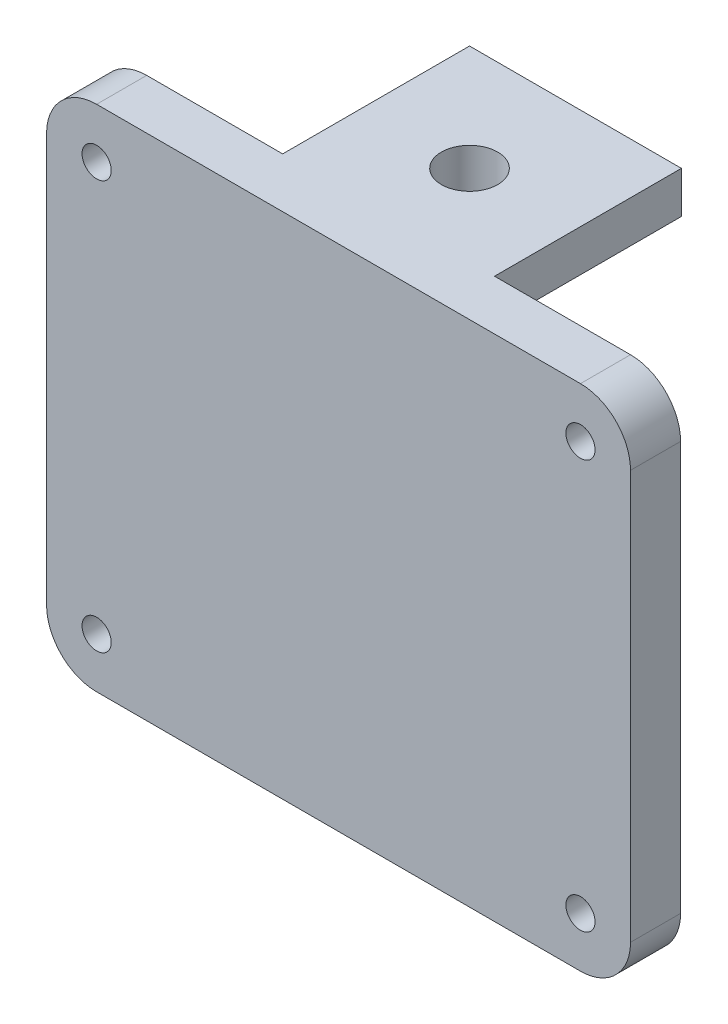
from build123d import *

# Parameters (mm, degrees)
SKETCH1_W               = 25.4
SKETCH1_H               = 25.4
BOSS_EXTRUDE1_DEPTH     = 5
F_1_4_CLEARANCE_HOLE1_D = 6.7564
SKETCH4_R               = 1.75
SKETCH4_W               = 25.4
SKETCH4_H               = 5
BOSS_EXTRUDE2_DEPTH     = 3
FILLET1_R               = 6


with BuildPart() as part:
    # Sketch1 → Boss-Extrude1 (new body)
    with BuildSketch(Plane(origin=(0, 0, 0), x_dir=(1, 0, 0), z_dir=(0, 1, 0))):
        Rectangle(SKETCH1_W, SKETCH1_H)
    extrude(amount=BOSS_EXTRUDE1_DEPTH)

    # 1/4 Clearance Hole1 (through all)
    with Locations(Plane(origin=(0, 5, 0), x_dir=(1, 0, 0), z_dir=(0, 1, 0))):
        with Locations((0, 0)):
            Hole(F_1_4_CLEARANCE_HOLE1_D / 2)

    # Sketch4 → Boss-Extrude2 (add, symmetric)
    # profile 1 of 2: a face of its own
    with BuildSketch(Plane.XY.offset(12.7)):
        Polygon((-35, 5), (-35, -56), (35, -56), (35, 5), (12.7, 5), (12.7, 0), (-12.7, 0), (-12.7, 5), align=None)
        with Locations((-29, -50)):
            Circle(SKETCH4_R, mode=Mode.SUBTRACT)
        with Locations((29, -50)):
            Circle(SKETCH4_R, mode=Mode.SUBTRACT)
        with Locations((-29, -1)):
            Circle(SKETCH4_R, mode=Mode.SUBTRACT)
        with Locations((29, -1)):
            Circle(SKETCH4_R, mode=Mode.SUBTRACT)
    # profile 2 of 2: a face of its own
    with BuildSketch(Plane.XY.offset(12.7)):
        with Locations((0, 2.5)):
            Rectangle(SKETCH4_W, SKETCH4_H)
    extrude(amount=BOSS_EXTRUDE2_DEPTH, both=True)

    # Fillet1
    fillet1_edges = [part.edges().sort_by_distance(p)[0] for p in [
        (-35, 5, 12.7),
        (35, 5, 12.7),
        (35, -56, 12.7),
        (-35, -56, 12.7),
    ]]
    fillet(fillet1_edges, radius=FILLET1_R)


solid = part.part
